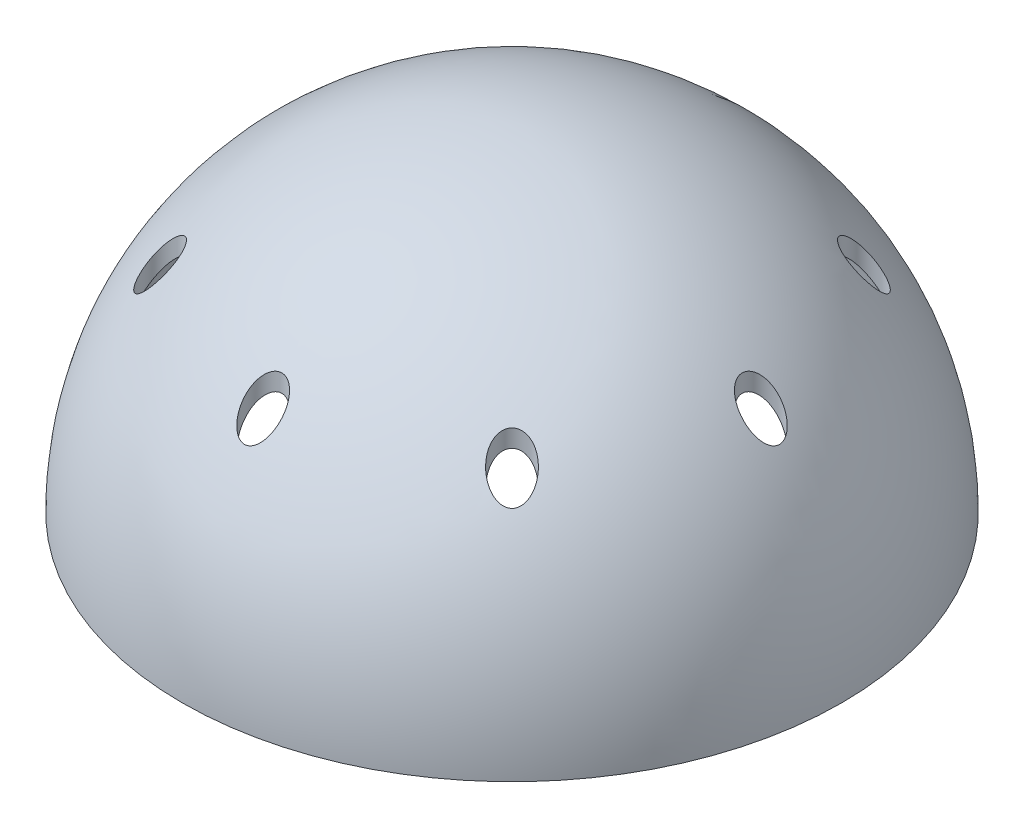
from build123d import *

# Parameters (mm, degrees)
REVOLVE1_ANGLE     = 180
SKETCH2_R          = 1.5
CUT_EXTRUDE1_DEPTH = 32


with BuildPart() as part:
    # Sketch1 → Revolve1 (revolve)
    with BuildSketch(Plane(origin=(0, 0, 0), x_dir=(1, 0, 0), z_dir=(0, 1, 0))):
        with BuildLine():
            Line((-26.5, 0), (-25.5, 0))
            ThreePointArc((-25.5, 0), (0, 25.5), (25.5, 0))
            Line((25.5, 0), (26.5, 0))
            ThreePointArc((26.5, 0), (0, 26.5), (-26.5, 0))
        make_face()
    revolve(axis=Axis((-25.5, 0, 0), (1, 0, 0)), revolution_arc=REVOLVE1_ANGLE)

    # Sketch2 → Cut-Extrude1 (cut)
    with BuildSketch(Plane.XZ):
        with Locations(Location((0, 20, 0), (0, 0, 121.275147362))):
            Circle(SKETCH2_R)
        with Locations(Location((14.142135624, 14.142135624, 0), (0, 0, 37.438589508))):
            Circle(SKETCH2_R)
        with Locations(Location((20, 0, 0), (0, 0, 322.876788318))):
            Circle(SKETCH2_R)
        with Locations(Location((14.142135624, -14.142135624, 0), (0, 0, 315))):
            Circle(SKETCH2_R)
        with Locations(Location((0, -20, 0), (0, 0, 245.695834375))):
            Circle(SKETCH2_R)
        with Locations(Location((-14.142135624, -14.142135624, 0), (0, 0, 225))):
            Circle(SKETCH2_R)
        with Locations(Location((-20, 0, 0), (0, 0, 222.011527199))):
            Circle(SKETCH2_R)
        with Locations(Location((-14.142135624, 14.142135624, 0), (0, 0, 142.561410492))):
            Circle(SKETCH2_R)
    extrude(amount=-CUT_EXTRUDE1_DEPTH, mode=Mode.SUBTRACT)


solid = part.part
